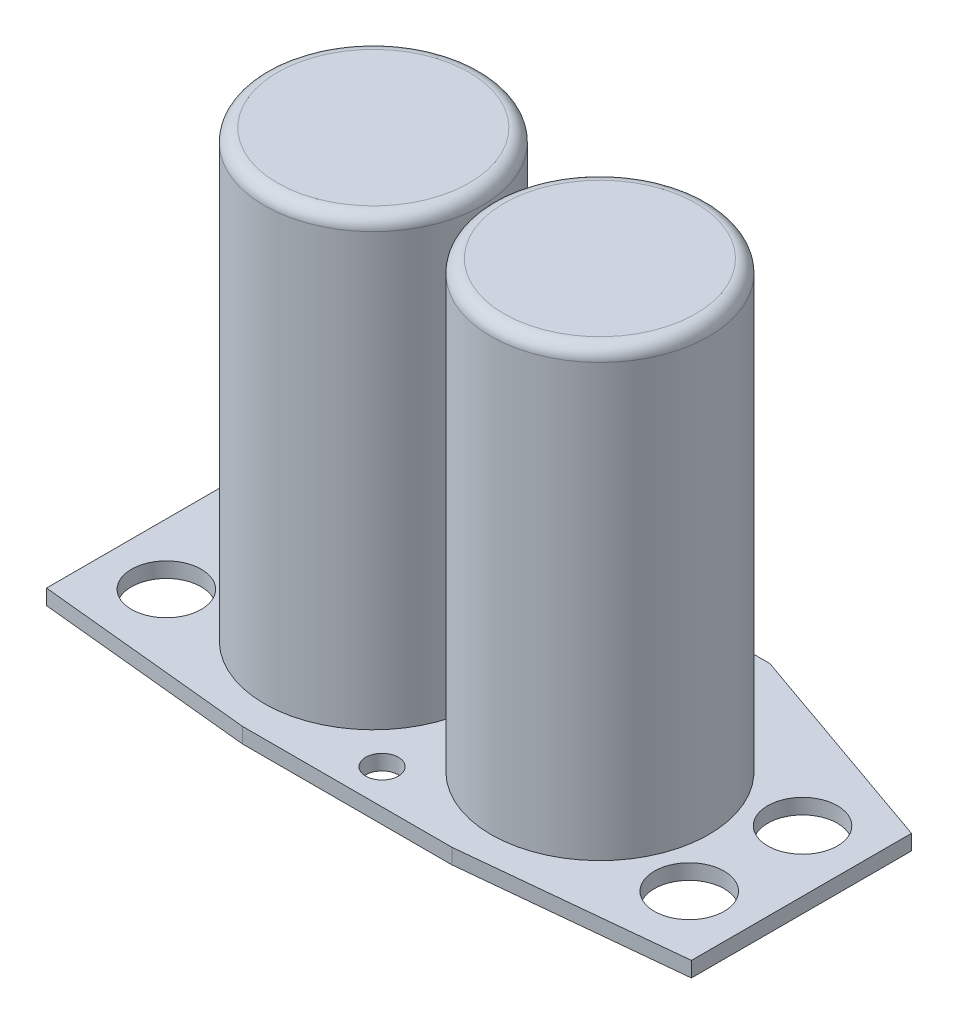
from build123d import *

# Parameters (mm, degrees)
SKETCH1_R           = 0.9525
BOSS_EXTRUDE1_DEPTH = 0.889
SKETCH3_R           = 6.35
BOSS_EXTRUDE2_DEPTH = 25.908
SKETCH2_R           = 2.032
CUT_EXTRUDE1_DEPTH  = 50.276654635
FILLET1_R           = 0.762


with BuildPart() as part:
    # Sketch1 → Boss-Extrude1 (new body)
    # profile 1 of 2: a face of its own
    with BuildSketch(Plane(origin=(0, 0, 0), x_dir=(1, 0, 0), z_dir=(0, 1, 0))):
        with BuildLine():
            Line((18.796, 2.9845), (18.796, 18.542))
            Line((18.796, 18.542), (12.7, 18.542))
            Line((12.7, 18.542), (0, 14.097))
            Line((0, 14.097), (0, 1.27))
            Line((0, 1.27), (12.7, 0))
            Line((12.7, 0), (18.796, 0))
            Line((18.796, 0), (18.796, 1.0795))
            ThreePointArc((18.796, 1.0795), (17.8435, 2.032), (18.796, 2.9845))
        make_face()
        with Locations(Location((13.208, 16.51, 0), (0, 0, 270))):
            Circle(SKETCH1_R, mode=Mode.SUBTRACT)
    # profile 2 of 2: a face of its own
    with BuildSketch(Plane(origin=(0, 0, 0), x_dir=(1, 0, 0), z_dir=(0, 1, 0))):
        with BuildLine():
            Line((24.892, 18.542), (18.796, 18.542))
            Line((18.796, 18.542), (18.796, 2.9845))
            ThreePointArc((18.796, 2.9845), (19.469519209, 2.705519209), (19.7485, 2.032))
            ThreePointArc((19.7485, 2.032), (19.469519209, 1.358480791), (18.796, 1.0795))
            Line((18.796, 1.0795), (18.796, 0))
            Line((18.796, 0), (24.892, 0))
            Line((24.892, 0), (37.592, 1.27))
            Line((37.592, 1.27), (37.592, 14.097))
            Line((37.592, 14.097), (24.892, 18.542))
        make_face()
        with Locations(Location((24.384, 16.51, 0), (0, 0, 270))):
            Circle(SKETCH1_R, mode=Mode.SUBTRACT)
    extrude(amount=BOSS_EXTRUDE1_DEPTH)

    # Sketch3 → Boss-Extrude2 (add)
    with BuildSketch(Plane(origin=(0, 0.889, 0), x_dir=(1, 0, 0), z_dir=(0, 1, 0))):
        with Locations(Location((12.192, 8.128, 0), (0, 0, 270))):
            Circle(SKETCH3_R)
        with Locations(Location((25.4, 8.128, 0), (0, 0, 270))):
            Circle(SKETCH3_R)
    extrude(amount=BOSS_EXTRUDE2_DEPTH)

    # Sketch2 → Cut-Extrude1 (cut, through all)
    with BuildSketch(Plane(origin=(0, 0.889, 0), x_dir=(1, 0, 0), z_dir=(0, 1, 0))):
        with Locations(Location((3.556, 11.303, 0), (0, 0, 270))):
            Circle(SKETCH2_R)
        with Locations(Location((3.556, 4.699, 0), (0, 0, 270))):
            Circle(SKETCH2_R)
        with Locations(Location((34.036, 4.699, 0), (0, 0, 90))):
            Circle(SKETCH2_R)
        with Locations(Location((34.036, 11.303, 0), (0, 0, 90))):
            Circle(SKETCH2_R)
    extrude(amount=-CUT_EXTRUDE1_DEPTH, mode=Mode.SUBTRACT)

    # Fillet1
    fillet1_edges = [part.edges().sort_by_distance(p)[0] for p in [
        (12.192, 26.797, -14.478),
        (25.4, 26.797, -14.478),
    ]]
    fillet(fillet1_edges, radius=FILLET1_R)


solid = part.part
